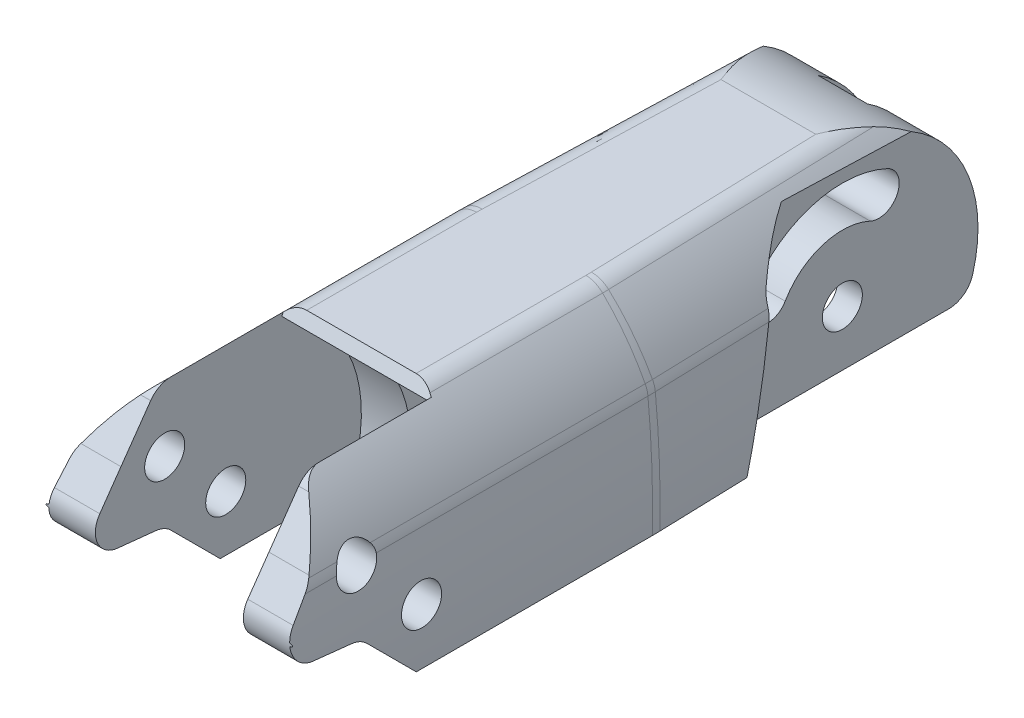
from build123d import *

# Parameters (mm, degrees)
SKETCH1_R               = 1.6250000000000004
SKETCH1_R_2             = 1.6249999999999911
BOSS_EXTRUDE1_DEPTH     = 10
CUT_EXTRUDE1_START      = -6
CUT_EXTRUDE1_DEPTH      = 11
CUT_EXTRUDE3_DEPTH      = 2
CUT_EXTRUDE4_DEPTH      = 2
CUT_EXTRUDE5_DEPTH      = 6
CUT_EXTRUDE6_DEPTH      = 34.48133823797317
CUT_EXTRUDE6_DEPTH_BACK = 34.48133823797317


with BuildPart() as part:
    # Sketch1 → Boss-Extrude1 (new body)
    with BuildSketch(Plane(origin=(0, 0, 0), x_dir=(0, 0, -1), z_dir=(1, 0, 0))):
        with BuildLine():
            Line((19, 10.99999999999998), (-22.944891997102822, 10.999999999999975))
            ThreePointArc((-22.944891997102822, 10.999999999999975), (-23.8683892235729, 10.774021666356417), (-24.58319608568082, 10.147152872702057))
            Line((-24.58319608568082, 10.147152872702057), (-29.21318039482684, 3.5348500103478613))
            ThreePointArc((-29.21318039482684, 3.5348500103478613), (-29.3943345500679, 1.5572925982802257), (-27.78170749955252, 0.39842067182294105))
            Line((-27.78170749955252, 0.39842067182294105), (-24.655439952238957, 0.07337301831343872))
            ThreePointArc((-24.655439952238957, 0.07337301831343872), (-24.002259017309658, -0.1102514491187252), (-23.448057583169525, -0.5016898851362983))
            Line((-23.448057583169525, -0.5016898851362983), (-19.449747468305834, -4.500000000000003))
            Line((-19.449747468305834, -4.500000000000003), (27.645808232895295, -4.5000000000000036))
            ThreePointArc((27.645808232895295, -4.5000000000000036), (28.84765865804996, -4.098610507770909), (29.56709895131647, -3.0555555555555545))
            ThreePointArc((29.56709895131647, -3.0555555555555545), (27.792357792739978, 6.610177338350635), (19, 10.99999999999998))
        make_face()
        with Locations((-19, -2.33e-15)):
            Circle(SKETCH1_R, mode=Mode.SUBTRACT)
        with Locations((19, -1.859e-14)):
            Circle(SKETCH1_R, mode=Mode.SUBTRACT)
        with Locations((-23.949747468305826, 4.94974746830584)):
            Circle(SKETCH1_R_2, mode=Mode.SUBTRACT)
        with BuildLine():
            ThreePointArc((21.261007700312703, 4.8487466606460785), (17.391223972652103, 5.102385686502985), (14.366764089753238, 2.6749999999999554))
            ThreePointArc((14.366764089753238, 2.6749999999999554), (12.112822173508919, 2.071058083755623), (11.508880257264584, 4.324999999999941))
            ThreePointArc((11.508880257264584, 4.324999999999941), (16.398894834287983, 8.249651623972127), (22.655647964056985, 7.839562357867033))
            ThreePointArc((22.655647964056985, 7.839562357867033), (23.453735680795315, 5.646834377384413), (21.261007700312703, 4.8487466606460785))
        make_face(mode=Mode.SUBTRACT)
    extrude(amount=BOSS_EXTRUDE1_DEPTH)

    # Sketch2 → Cut-Extrude1 (cut)
    with BuildSketch(Plane.ZY.offset(CUT_EXTRUDE1_START)):
        with BuildLine():
            Line((-19, 10.99999999999998), (-12.5, 10.99999999999998))
            Line((-12.5, 10.99999999999998), (-15, 10.246950765959578))
            ThreePointArc((-15, 10.246950765959578), (-12.487549940014954, 8.864986983419685), (-10.417635888689937, 6.880626879935924))
            ThreePointArc((-10.417635888689937, 6.880626879935924), (-10.177824326044544, 6.50088499273199), (-10.02879600577582, 6.077205814303888))
            Line((-10.02879600577582, 6.077205814303888), (-7.6, -4.500000000000002))
            Line((-7.6, -4.500000000000002), (-8.962570050057629, -4.500000000000003))
            ThreePointArc((-8.962570050057629, -4.500000000000003), (-28.23309265630969, -5.9791303715507205), (-19, 10.99999999999998))
        make_face()
    extrude(amount=-CUT_EXTRUDE1_DEPTH, mode=Mode.SUBTRACT)

    # Cut-Sweep1: sweep along a path in Sketch11
    with BuildLine(Plane(origin=(0, 0, 0), x_dir=(1, 0, 0), z_dir=(0, 1, 0))) as cut_sweep1_path:
        Line((10, -29.574876306248854), (10, -0.3111235664276255))
        ThreePointArc((10, -0.3111235664276255), (9.99758049228248, -3.763829330233e-05), (9.990322554531664, 0.31097302236062707))
        Line((9.990322554531664, 0.31097302236062707), (8.999999999999996, 32.13379226764415))
    # Sketch3 → Cut-Sweep1 (sweep, cut)
    with BuildSketch(Plane.XY):
        with BuildLine():
            Line((0, 10.999999999999975), (4.431093425838618, 10.999999999999973))
            ThreePointArc((4.431093425838618, 10.999999999999973), (5.170508303276815, 10.858296434647324), (5.80514545630723, 10.453265639023032))
            ThreePointArc((5.80514545630723, 10.453265639023032), (7.744094055037851, 8.298848484633577), (9.312115780209595, 5.861156376709278))
            ThreePointArc((9.312115780209595, 5.861156376709278), (9.46237662264063, 5.498379306707154), (9.538860607954978, 5.113235537086192))
            ThreePointArc((9.538860607954978, 5.113235537086192), (9.864060328551147, 0.31205106921949133), (9.900000000000002, -4.499999999999999))
            Line((9.900000000000002, -4.499999999999999), (12.300316144306437, -4.499999999999999))
            Line((12.300316144306437, -4.499999999999999), (12.300316144306434, 12.084294584184489))
            Line((12.300316144306434, 12.084294584184489), (0, 12.084294584184489))
            Line((0, 12.084294584184489), (0, 10.999999999999975))
        make_face()
    sweep(path=cut_sweep1_path.line, mode=Mode.SUBTRACT)

    # Sketch4 → Cut-Extrude3 (cut)
    with BuildSketch(Plane(origin=(0, 0, 0), x_dir=(0, 0, -1), z_dir=(1, 0, 0))):
        Polygon((33.532409354919174, 9.199999999999982), (-30.89089579464006, 9.199999999999974), (-30.89089579464006, -9.344433408950492), (33.532409354919174, -9.344433408950492), align=None)
    extrude(amount=CUT_EXTRUDE3_DEPTH, mode=Mode.SUBTRACT)

    # Sketch5 → Cut-Extrude4 (cut)
    with BuildSketch(Plane.ZY.offset(-2)):
        with BuildLine():
            Line((-35.22452566785832, -1.859e-14), (-23.8541219597369, -1.859e-14))
            ThreePointArc((-23.8541219597369, -1.859e-14), (-22.741424679208528, 0.33810206032234813), (-22.004932641741892, 1.238095238095219))
            ThreePointArc((-22.004932641741892, 1.238095238095219), (-19, 3.2499999999999827), (-15.995067358258108, 1.23809523809522))
            ThreePointArc((-15.995067358258108, 1.23809523809522), (-15.258575320791474, 0.3381020603223486), (-14.1458780402631, -1.776e-14))
            Line((-14.1458780402631, -1.776e-14), (14.145878040263101, -3.16e-15))
            ThreePointArc((14.145878040263101, -3.16e-15), (15.258575320791474, 0.3381020603223641), (15.995067358258108, 1.238095238095235))
            ThreePointArc((15.995067358258108, 1.238095238095235), (19, 3.249999999999999), (22.004932641741892, 1.2380952380952355))
            ThreePointArc((22.004932641741892, 1.2380952380952355), (22.741424679208528, 0.33810206032236456), (23.8541219597369, -2.33e-15))
            Line((23.8541219597369, -2.33e-15), (29.38141128636384, -2.33e-15))
            Line((29.38141128636384, -2.33e-15), (29.38141128636384, -9.822135841672047))
            Line((29.38141128636384, -9.822135841672047), (-35.22452566785832, -9.822135841672047))
            Line((-35.22452566785832, -9.822135841672047), (-35.22452566785832, -1.859e-14))
        make_face()
    extrude(amount=-CUT_EXTRUDE4_DEPTH, mode=Mode.SUBTRACT)

    # Mirror1: part across plane


with BuildPart() as part_1:
    add(part.part)
    add(part.part.mirror(Plane(origin=(0, -2.500000000000002, -27.645808232895295), x_dir=(0, 0, 1), z_dir=(1, 0, 0))))

    # Sketch10 → Cut-Extrude5 (cut, symmetric)
    with BuildSketch(Plane(origin=(0, 0, 0), x_dir=(0, 0, -1), z_dir=(1, 0, 0))):
        with BuildLine():
            Line((-19, 10.999999999999998), (-30, 10.999999999999996))
            Line((-30, 10.999999999999996), (-30, 0))
            ThreePointArc((-30, 0), (-13.044756774926967, -9.248517617987316), (-14.448167612686968, 10.014031252088644))
            Line((-14.448167612686968, 10.014031252088644), (-13.999999999999998, 10.999999999999973))
            Line((-13.999999999999998, 10.999999999999973), (-19, 10.999999999999998))
        make_face()
    extrude(amount=CUT_EXTRUDE5_DEPTH, both=True, mode=Mode.SUBTRACT)

    # Sketch12 → Cut-Extrude6 (cut, two sides: drawn at the far end of the back side and taken through both)
    with BuildSketch(Plane(origin=(0, 0, 0), x_dir=(0, 0, -1), z_dir=(1, 0, 0)).offset(-CUT_EXTRUDE6_DEPTH_BACK)):
        with BuildLine():
            Line((-14.33223977944562, 10.269072485219604), (-23.450966193311796, 10.269072485219604))
            ThreePointArc((-23.450966193311796, 10.269072485219604), (-24.37347053074487, 10.043610663850082), (-25.087985360039003, 9.418058232636774))
            Line((-25.087985360039003, 9.418058232636774), (-27.496590401007584, 5.986394588414307))
            Line((-27.496590401007584, 5.986394588414307), (-33.68110322049983, 5.986394588414307))
            Line((-33.68110322049983, 5.986394588414307), (-33.68110322049983, 15.721411191063343))
            Line((-33.68110322049983, 15.721411191063343), (-14.33223977944562, 15.721411191063343))
            Line((-14.33223977944562, 15.721411191063343), (-14.33223977944562, 10.269072485219604))
        make_face()
    extrude(amount=CUT_EXTRUDE6_DEPTH + CUT_EXTRUDE6_DEPTH_BACK, mode=Mode.SUBTRACT)


solid = part_1.part
